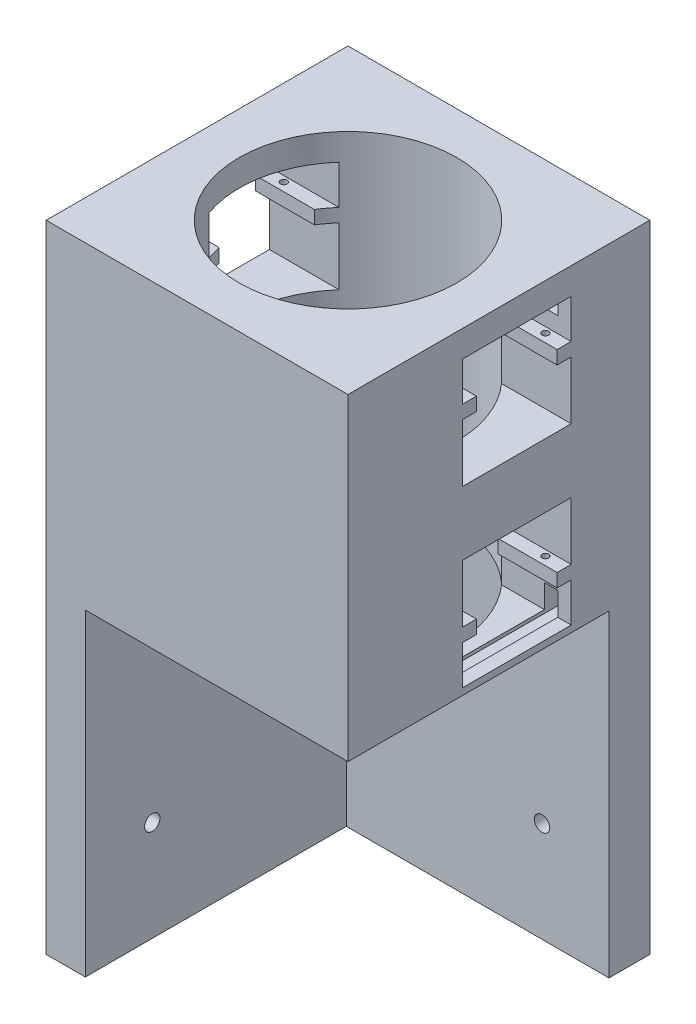
from build123d import *

# Parameters (mm, degrees)
SKETCH2_W                      = 90.2
SKETCH2_H                      = 90.2
SKETCH2_R                      = 32.5
BOSS_EXTRUDE2_DEPTH            = 250
SKETCH3_W                      = 78.5
SKETCH3_H                      = 115
CUT_EXTRUDE1_DEPTH             = 78
SKETCH6_W                      = 32.5
SKETCH6_H                      = 33
CUT_EXTRUDE4_DEPTH             = 32.6
MIRROR3_COPY_1_SKETCH_W        = 32.5
MIRROR3_COPY_1_SKETCH_H        = 33
MIRROR3_COPY_1_DEPTH           = 32.6
MIRROR3_COPY_2_SKETCH_W        = 32.5
MIRROR3_COPY_2_SKETCH_H        = 33
MIRROR3_COPY_2_DEPTH           = 32.6
CUT_EXTRUDE5_REACH             = 271.574
SKETCH10_W                     = 4
SKETCH10_H                     = 8
CUT_EXTRUDE5_DIRECTION_2_DEPTH = 270.573830332
SKETCH11_W                     = 4
SKETCH11_H                     = 200
CUT_EXTRUDE6_DEPTH             = 3
MIRROR7_COPY_1_REACH           = 271.574
MIRROR7_COPY_1_SKETCH_W        = 4
MIRROR7_COPY_1_SKETCH_H        = 8
MIRROR7_COPY_2_SKETCH_W        = 4
MIRROR7_COPY_2_SKETCH_H        = 8
MIRROR7_COPY_2_DEPTH           = 270.573830332
MIRROR7_COPY_3_REACH           = 271.574
MIRROR7_COPY_3_SKETCH_W        = 4
MIRROR7_COPY_3_SKETCH_H        = 8
MIRROR7_COPY_4_SKETCH_W        = 4
MIRROR7_COPY_4_SKETCH_H        = 8
MIRROR7_COPY_4_DEPTH           = 270.573830332
SKETCH12_W                     = 20.816466484
SKETCH12_H                     = 4
BOSS_EXTRUDE3_DEPTH            = 4.2
SKETCH13_R                     = 1
CUT_EXTRUDE7_DEPTH             = 10
MIRROR9_COPY_1_SKETCH_W        = 20.816466484
MIRROR9_COPY_1_SKETCH_H        = 4
MIRROR9_COPY_1_DEPTH           = 4.2
MIRROR9_COPY_2_SKETCH_R        = 1
MIRROR9_COPY_2_DEPTH           = 10
MIRROR10_COPY_1_SKETCH_W       = 20.816466484
MIRROR10_COPY_1_SKETCH_H       = 4
MIRROR10_COPY_1_DEPTH          = 4.2
MIRROR10_COPY_2_SKETCH_R       = 1
MIRROR10_COPY_2_DEPTH          = 10
MIRROR10_COPY_3_SKETCH_W       = 20.816466484
MIRROR10_COPY_3_SKETCH_H       = 4
MIRROR10_COPY_3_DEPTH          = 4.2
MIRROR10_COPY_4_SKETCH_R       = 1
MIRROR10_COPY_4_DEPTH          = 10
MIRROR10_COPY_5_SKETCH_W       = 20.816466484
MIRROR10_COPY_5_SKETCH_H       = 4
MIRROR10_COPY_5_DEPTH          = 4.2
MIRROR10_COPY_6_SKETCH_R       = 1
MIRROR10_COPY_6_DEPTH          = 10
CUT_EXTRUDE8_START             = -1000
SKETCH14_R                     = 32.5
CUT_EXTRUDE8_DEPTH             = 1000
SKETCH15_W                     = 90.2
SKETCH15_H                     = 39.974184268
CUT_EXTRUDE9_DEPTH             = 270.573830332
SKETCH16_W                     = 90.2
SKETCH16_H                     = 20
CUT_EXTRUDE10_DEPTH            = 233.982602942
SKETCH19_R                     = 2.3
CUT_EXTRUDE11_DEPTH            = 233.982602942
CIRPATTERN1_COUNT              = 2
CIRPATTERN1_ANGLE              = 90


with BuildPart() as part:
    # Sketch2 → Boss-Extrude2 (new body)
    with BuildSketch(Plane(origin=(0, 0, 0), x_dir=(1, 0, 0), z_dir=(0, 1, 0))):
        Rectangle(SKETCH2_W, SKETCH2_H)
        with Locations(Location((0, 0, 0), (0, 0, 270))):
            Circle(SKETCH2_R, mode=Mode.SUBTRACT)
    extrude(amount=BOSS_EXTRUDE2_DEPTH)

    # Sketch3 → Cut-Extrude1 (cut)
    with BuildSketch(Plane.XY.offset(45.1)):
        with Locations((5.85, 57.5)):
            Rectangle(SKETCH3_W, SKETCH3_H)
    extrude(amount=-CUT_EXTRUDE1_DEPTH, mode=Mode.SUBTRACT)

    # Sketch6 → Cut-Extrude4 (cut)
    with BuildSketch(Plane(origin=(45.1, 0, 0), x_dir=(0, 0, -1), z_dir=(1, 0, 0))):
        with Locations((5.35, 133.5)):
            Rectangle(SKETCH6_W, SKETCH6_H)
    cut_extrude4 = extrude(amount=-CUT_EXTRUDE4_DEPTH, mode=Mode.SUBTRACT)

    # Mirror1: Cut-Extrude4 across plane
    add(cut_extrude4.mirror(Plane(origin=(0, 0, 0), x_dir=(0, 0, 1), z_dir=(1, 0, 0))), mode=Mode.SUBTRACT)

    # Mirror2: Cut-Extrude4 across plane
    add(cut_extrude4.mirror(Plane(origin=(0, 159.55, 0), x_dir=(0, 0, 1), z_dir=(0, -1, 0))), mode=Mode.SUBTRACT)

    # Mirror3 copy 1 sketch → Mirror3 copy 1 (cut)
    with BuildSketch(Plane(origin=(-45.1, 319.1, 0), x_dir=(0, 0, -1), z_dir=(-1, 0, 0))):
        with Locations((5.35, 133.5)):
            Rectangle(MIRROR3_COPY_1_SKETCH_W, MIRROR3_COPY_1_SKETCH_H)
    extrude(amount=-MIRROR3_COPY_1_DEPTH, mode=Mode.SUBTRACT)

    # Mirror3 copy 2 sketch → Mirror3 copy 2 (cut)
    with BuildSketch(Plane(origin=(-45.1, 0, 0), x_dir=(0, 0, -1), z_dir=(-1, 0, 0))):
        with Locations((5.35, -133.5)):
            Rectangle(MIRROR3_COPY_2_SKETCH_W, MIRROR3_COPY_2_SKETCH_H)
    extrude(amount=-MIRROR3_COPY_2_DEPTH, mode=Mode.SUBTRACT)

    # Cut-Extrude5: up to this face of the body (flat: up to its plane)
    cut_extrude5_end = Plane(part.part.faces().sort_by_distance((37.858820987, 185.6, 10.9))[0])
    # Sketch10 → Cut-Extrude5 (cut, up to the picked face)
    with BuildSketch(Plane(origin=(0, 0, -45.1), x_dir=(-1, 0, 0), z_dir=(0, 0, -1)), mode=Mode.PRIVATE) as cut_extrude5_sk1:
        with Locations((-39.1, 199.1)):
            Rectangle(SKETCH10_W, SKETCH10_H)
    cut_extrude5_tool1 = split(extrude(cut_extrude5_sk1.sketch, amount=-CUT_EXTRUDE5_REACH, mode=Mode.PRIVATE), bisect_by=cut_extrude5_end, keep=Keep.BOTH, mode=Mode.PRIVATE)
    cut_extrude5 = cut_extrude5_tool1.solids().sort_by(Axis((39.1, 199.1, -45.1), (0, 0, 1)))[0]
    add(cut_extrude5, mode=Mode.SUBTRACT)

    # Sketch10 → Cut-Extrude5 direction 2 (cut)
    with BuildSketch(Plane(origin=(0, 0, -45.1), x_dir=(-1, 0, 0), z_dir=(0, 0, -1))):
        with Locations((-39.1, 199.1)):
            Rectangle(SKETCH10_W, SKETCH10_H)
    cut_extrude5_direction_2 = extrude(amount=CUT_EXTRUDE5_DIRECTION_2_DEPTH, mode=Mode.SUBTRACT)

    # Sketch11 → Cut-Extrude6 (cut)
    with BuildSketch(Plane(origin=(0, 0, -45.1), x_dir=(-1, 0, 0), z_dir=(0, 0, -1))):
        with Locations((-39.1, 95.1)):
            Rectangle(SKETCH11_W, SKETCH11_H)
    cut_extrude6 = extrude(amount=-CUT_EXTRUDE6_DEPTH, mode=Mode.SUBTRACT)

    # Mirror4: Cut-Extrude5, Cut-Extrude5 direction 2 across plane
    add(cut_extrude5.mirror(Plane(origin=(0, 159.55, 0), x_dir=(0, 0, 1), z_dir=(0, -1, 0))), mode=Mode.SUBTRACT)
    add(cut_extrude5_direction_2.mirror(Plane(origin=(0, 159.55, 0), x_dir=(0, 0, 1), z_dir=(0, -1, 0))), mode=Mode.SUBTRACT)

    # Mirror5: Cut-Extrude5, Cut-Extrude5 direction 2 across plane
    add(cut_extrude5.mirror(Plane(origin=(0, 0, 0), x_dir=(0, 0, 1), z_dir=(1, 0, 0))), mode=Mode.SUBTRACT)
    add(cut_extrude5_direction_2.mirror(Plane(origin=(0, 0, 0), x_dir=(0, 0, 1), z_dir=(1, 0, 0))), mode=Mode.SUBTRACT)

    # Mirror6: Cut-Extrude6 across plane
    add(cut_extrude6.mirror(Plane(origin=(0, 0, 0), x_dir=(0, 0, 1), z_dir=(1, 0, 0))), mode=Mode.SUBTRACT)

    # Mirror7 copy 1: up to this face of the body (flat: up to its plane)
    mirror7_copy_1_end = Plane(part.part.faces().sort_by_distance((-37.858820987, 133.5, 10.9))[0])
    # Mirror7 copy 1 sketch → Mirror7 copy 1 (cut, up to the picked face)
    with BuildSketch(Plane(origin=(0, 319.1, -45.1), x_dir=(1, 0, 0), z_dir=(0, 0, -1)), mode=Mode.PRIVATE) as mirror7_copy_1_sk1:
        with Locations((-39.1, 199.1)):
            Rectangle(MIRROR7_COPY_1_SKETCH_W, MIRROR7_COPY_1_SKETCH_H)
    mirror7_copy_1_tool1 = split(extrude(mirror7_copy_1_sk1.sketch, amount=-MIRROR7_COPY_1_REACH, mode=Mode.PRIVATE), bisect_by=mirror7_copy_1_end, keep=Keep.BOTH, mode=Mode.PRIVATE)
    add(mirror7_copy_1_tool1.solids().sort_by(Axis((-39.1, 120, -45.1), (0, 0, 1)))[0], mode=Mode.SUBTRACT)

    # Mirror7 copy 2 sketch → Mirror7 copy 2 (cut)
    with BuildSketch(Plane(origin=(0, 319.1, -45.1), x_dir=(1, 0, 0), z_dir=(0, 0, -1))):
        with Locations((-39.1, 199.1)):
            Rectangle(MIRROR7_COPY_2_SKETCH_W, MIRROR7_COPY_2_SKETCH_H)
    extrude(amount=MIRROR7_COPY_2_DEPTH, mode=Mode.SUBTRACT)

    # Mirror7 copy 3: up to this face of the body (flat: up to its plane)
    mirror7_copy_3_end = Plane(part.part.faces().sort_by_distance((-37.858820987, 185.6, 10.9))[0])
    # Mirror7 copy 3 sketch → Mirror7 copy 3 (cut, up to the picked face)
    with BuildSketch(Plane(origin=(0, 0, -45.1), x_dir=(1, 0, 0), z_dir=(0, 0, -1)), mode=Mode.PRIVATE) as mirror7_copy_3_sk1:
        with Locations((-39.1, -199.1)):
            Rectangle(MIRROR7_COPY_3_SKETCH_W, MIRROR7_COPY_3_SKETCH_H)
    mirror7_copy_3_tool1 = split(extrude(mirror7_copy_3_sk1.sketch, amount=-MIRROR7_COPY_3_REACH, mode=Mode.PRIVATE), bisect_by=mirror7_copy_3_end, keep=Keep.BOTH, mode=Mode.PRIVATE)
    add(mirror7_copy_3_tool1.solids().sort_by(Axis((-39.1, 199.1, -45.1), (0, 0, 1)))[0], mode=Mode.SUBTRACT)

    # Mirror7 copy 4 sketch → Mirror7 copy 4 (cut)
    with BuildSketch(Plane(origin=(0, 0, -45.1), x_dir=(1, 0, 0), z_dir=(0, 0, -1))):
        with Locations((-39.1, -199.1)):
            Rectangle(MIRROR7_COPY_4_SKETCH_W, MIRROR7_COPY_4_SKETCH_H)
    extrude(amount=MIRROR7_COPY_4_DEPTH, mode=Mode.SUBTRACT)

    # Sketch12 → Boss-Extrude3 (add)
    with BuildSketch(Plane.XY.offset(-21.6)):
        with Locations((34.691766758, 188.4)):
            Rectangle(SKETCH12_W, SKETCH12_H)
    boss_extrude3 = extrude(amount=BOSS_EXTRUDE3_DEPTH)

    # Sketch13 → Cut-Extrude7 (cut)
    with BuildSketch(Plane(origin=(0, 190.4, 0), x_dir=(1, 0, 0), z_dir=(0, 1, 0))):
        with Locations(Location((39.1, 19.91, 0), (0, 0, 270))):
            Circle(SKETCH13_R)
    cut_extrude7 = extrude(amount=-CUT_EXTRUDE7_DEPTH, mode=Mode.SUBTRACT)

    # Mirror8: Boss-Extrude3, Cut-Extrude7 across plane
    add(boss_extrude3.mirror(Plane(origin=(0, 0, -5.35), x_dir=(1, 0, 0), z_dir=(0, 0, -1))))
    add(cut_extrude7.mirror(Plane(origin=(0, 0, -5.35), x_dir=(1, 0, 0), z_dir=(0, 0, -1))), mode=Mode.SUBTRACT)

    # Mirror9: Boss-Extrude3, Cut-Extrude7 across plane
    add(boss_extrude3.mirror(Plane(origin=(0, 159.55, 0), x_dir=(0, 0, 1), z_dir=(0, -1, 0))))
    add(cut_extrude7.mirror(Plane(origin=(0, 159.55, 0), x_dir=(0, 0, 1), z_dir=(0, -1, 0))), mode=Mode.SUBTRACT)

    # Mirror9 copy 1 sketch → Mirror9 copy 1 (add)
    with BuildSketch(Plane(origin=(0, 319.1, 10.9), x_dir=(1, 0, 0), z_dir=(0, 0, -1))):
        with Locations((34.691766758, 188.4)):
            Rectangle(MIRROR9_COPY_1_SKETCH_W, MIRROR9_COPY_1_SKETCH_H)
    extrude(amount=MIRROR9_COPY_1_DEPTH)

    # Mirror9 copy 2 sketch → Mirror9 copy 2 (cut)
    with BuildSketch(Plane(origin=(0, 128.7, -10.7), x_dir=(1, 0, 0), z_dir=(0, -1, 0))):
        with Locations(Location((39.1, 19.91, 0), (0, 0, 270))):
            Circle(MIRROR9_COPY_2_SKETCH_R)
    extrude(amount=-MIRROR9_COPY_2_DEPTH, mode=Mode.SUBTRACT)

    # Mirror10: Boss-Extrude3, Cut-Extrude7 across plane
    add(boss_extrude3.mirror(Plane(origin=(0, 0, 0), x_dir=(0, 0, 1), z_dir=(1, 0, 0))))
    add(cut_extrude7.mirror(Plane(origin=(0, 0, 0), x_dir=(0, 0, 1), z_dir=(1, 0, 0))), mode=Mode.SUBTRACT)

    # Mirror10 copy 1 sketch → Mirror10 copy 1 (add)
    with BuildSketch(Plane(origin=(0, 0, 10.9), x_dir=(-1, 0, 0), z_dir=(0, 0, -1))):
        with Locations((34.691766758, 188.4)):
            Rectangle(MIRROR10_COPY_1_SKETCH_W, MIRROR10_COPY_1_SKETCH_H)
    extrude(amount=MIRROR10_COPY_1_DEPTH)

    # Mirror10 copy 2 sketch → Mirror10 copy 2 (cut)
    with BuildSketch(Plane(origin=(0, 190.4, -10.7), x_dir=(-1, 0, 0), z_dir=(0, 1, 0))):
        with Locations(Location((39.1, 19.91, 0), (0, 0, 270))):
            Circle(MIRROR10_COPY_2_SKETCH_R)
    extrude(amount=-MIRROR10_COPY_2_DEPTH, mode=Mode.SUBTRACT)

    # Mirror10 copy 3 sketch → Mirror10 copy 3 (add)
    with BuildSketch(Plane(origin=(0, 319.1, -21.6), x_dir=(-1, 0, 0), z_dir=(0, 0, 1))):
        with Locations((34.691766758, 188.4)):
            Rectangle(MIRROR10_COPY_3_SKETCH_W, MIRROR10_COPY_3_SKETCH_H)
    extrude(amount=MIRROR10_COPY_3_DEPTH)

    # Mirror10 copy 4 sketch → Mirror10 copy 4 (cut)
    with BuildSketch(Plane(origin=(0, 128.7, 0), x_dir=(-1, 0, 0), z_dir=(0, -1, 0))):
        with Locations(Location((39.1, 19.91, 0), (0, 0, 270))):
            Circle(MIRROR10_COPY_4_SKETCH_R)
    extrude(amount=-MIRROR10_COPY_4_DEPTH, mode=Mode.SUBTRACT)

    # Mirror10 copy 5 sketch → Mirror10 copy 5 (add)
    with BuildSketch(Plane(origin=(0, 319.1, 10.9), x_dir=(-1, 0, 0), z_dir=(0, 0, -1))):
        with Locations((34.691766758, -188.4)):
            Rectangle(MIRROR10_COPY_5_SKETCH_W, MIRROR10_COPY_5_SKETCH_H)
    extrude(amount=MIRROR10_COPY_5_DEPTH)

    # Mirror10 copy 6 sketch → Mirror10 copy 6 (cut)
    with BuildSketch(Plane(origin=(0, 128.7, -10.7), x_dir=(-1, 0, 0), z_dir=(0, -1, 0))):
        with Locations((39.1, -19.91)):
            Circle(MIRROR10_COPY_6_SKETCH_R)
    extrude(amount=-MIRROR10_COPY_6_DEPTH, mode=Mode.SUBTRACT)

    # Sketch14 → Cut-Extrude8 (cut)
    with BuildSketch(Plane(origin=(0, 250, 0), x_dir=(1, 0, 0), z_dir=(0, 1, 0)).offset(CUT_EXTRUDE8_START)):
        with Locations(Location((0, 0, 0), (0, 0, 270))):
            Circle(SKETCH14_R)
    extrude(amount=CUT_EXTRUDE8_DEPTH, mode=Mode.SUBTRACT)

    # Sketch15 → Cut-Extrude9 (cut, through all)
    with BuildSketch(Plane(origin=(45.1, 0, 0), x_dir=(0, 0, -1), z_dir=(1, 0, 0))):
        with Locations((0, 230.012907866)):
            Rectangle(SKETCH15_W, SKETCH15_H)
    extrude(amount=-CUT_EXTRUDE9_DEPTH, mode=Mode.SUBTRACT)

    # Sketch16 → Cut-Extrude10 (cut, through all)
    with BuildSketch(Plane(origin=(45.1, 0, 0), x_dir=(0, 0, -1), z_dir=(1, 0, 0))):
        with Locations((0, 10)):
            Rectangle(SKETCH16_W, SKETCH16_H)
    extrude(amount=-CUT_EXTRUDE10_DEPTH, mode=Mode.SUBTRACT)

    # Sketch19 → Cut-Extrude11 (cut, through all)
    with BuildSketch(Plane.ZY.offset(45.1)):
        with Locations((-25.1, 50)):
            Circle(SKETCH19_R)
        with Locations((25.1, 50)):
            Circle(SKETCH19_R)
    cut_extrude11 = extrude(amount=-CUT_EXTRUDE11_DEPTH, mode=Mode.SUBTRACT)

    # CirPattern1: Cut-Extrude11 ×2 about axis
    cirpattern1_axis = Axis((0, 210.025815732, 0), (0, -1, 0))
    for i in range(1, CIRPATTERN1_COUNT):
        add(cut_extrude11.rotate(cirpattern1_axis, i * CIRPATTERN1_ANGLE / (CIRPATTERN1_COUNT - 1)), mode=Mode.SUBTRACT)


solid = part.part
